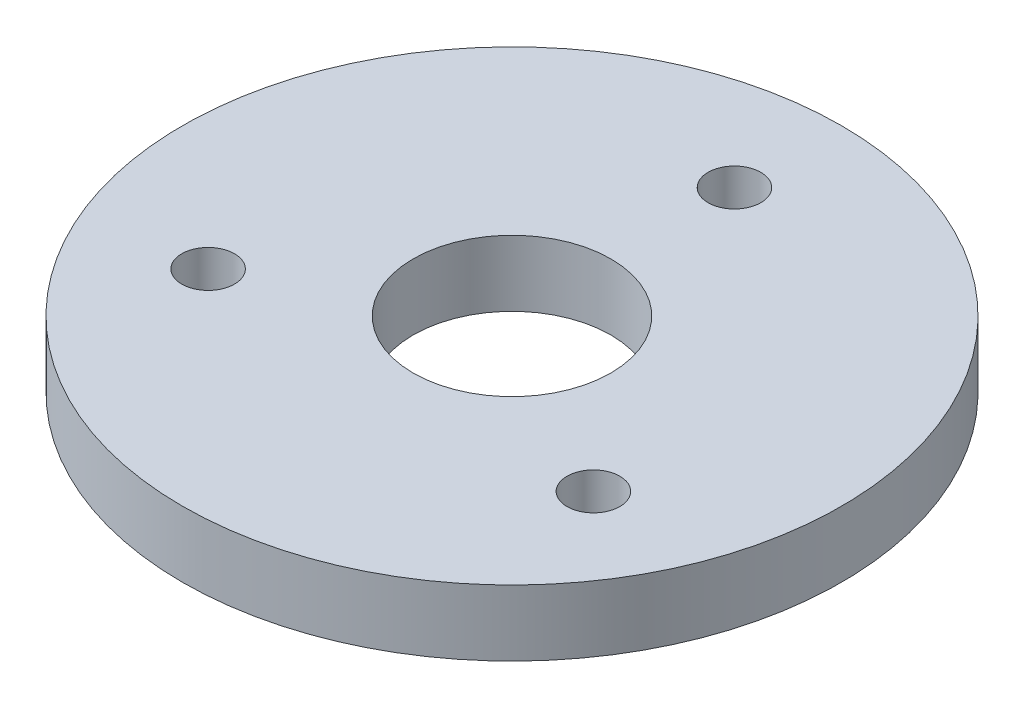
from build123d import *

# Parameters (mm, degrees)
SKETCH_1_R      = 20
SKETCH_1_R_2    = 1.6
SKETCH_1_R_3    = 6
EXTRUDE_1_DEPTH = 4


with BuildPart() as part:
    # 草图1 → 凸台-拉伸1 (new body)
    with BuildSketch(Plane(origin=(0, 0, 0), x_dir=(1, 0, 0), z_dir=(0, 1, 0))):
        with Locations(Location((0, 0, 0), (0, 0, 270))):
            Circle(SKETCH_1_R)
        with Locations(Location((0, 13.5, 0), (0, 0, 270))):
            Circle(SKETCH_1_R_2, mode=Mode.SUBTRACT)
        with Locations(Location((11.691342951, -6.75, 0), (0, 0, 270))):
            Circle(SKETCH_1_R_2, mode=Mode.SUBTRACT)
        with Locations(Location((-11.691342951, -6.75, 0), (0, 0, 270))):
            Circle(SKETCH_1_R_2, mode=Mode.SUBTRACT)
        with Locations(Location((0, 0, 0), (0, 0, 270))):
            Circle(SKETCH_1_R_3, mode=Mode.SUBTRACT)
    extrude(amount=EXTRUDE_1_DEPTH)


solid = part.part
